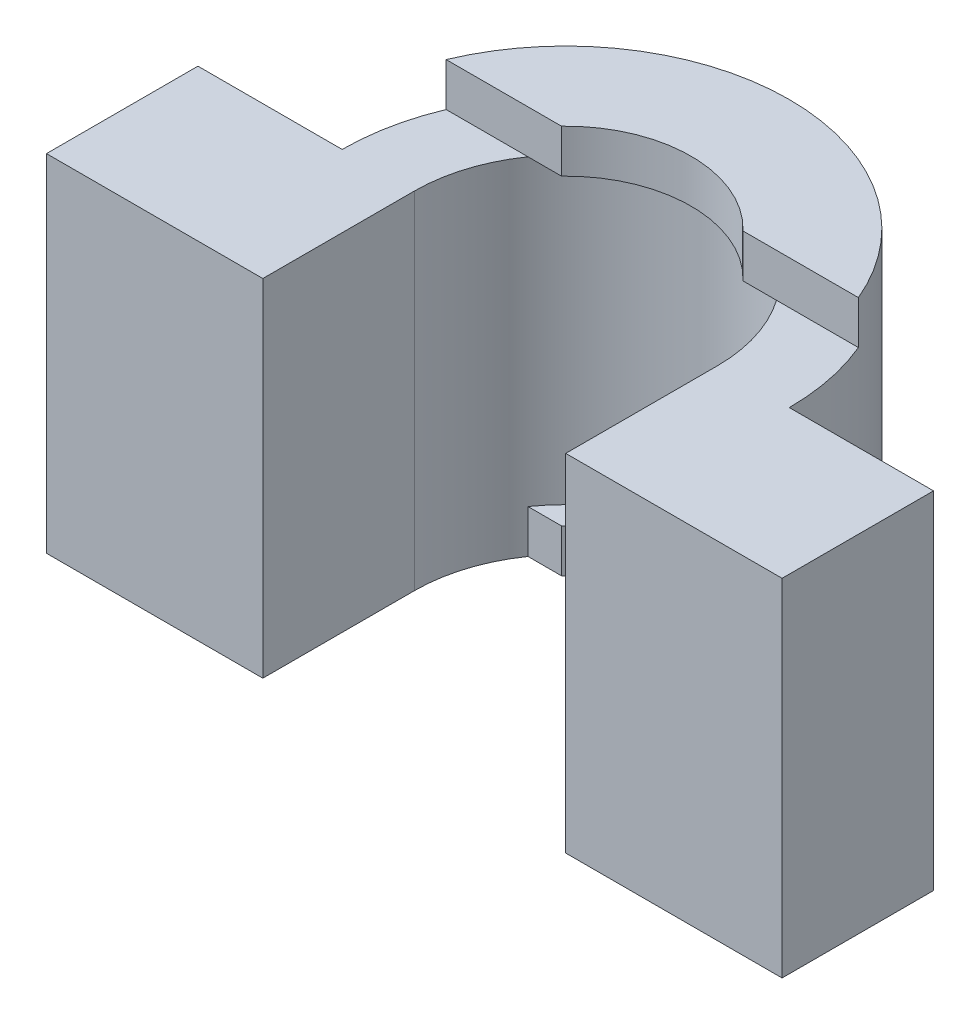
from build123d import *

# Parameters (mm, degrees)
BOSS_EXTRU_1_DEPTH = 21
BOSS_EXTRU_2_DEPTH = 3
BOSS_EXTRU_3_START = 3
BOSS_EXTRU_3_DEPTH = 3
BOSS_EXTRU_5_START = 3
BOSS_EXTRU_5_DEPTH = 3


with BuildPart() as part:
    # Esquisse1 → Boss.-Extru.1 (new body)
    with BuildSketch(Plane(origin=(0, 0, 0), x_dir=(1, 0, 0), z_dir=(0, 1, 0))):
        with BuildLine():
            ThreePointArc((-19.357142857, 1.428571429), (-3.857142857, 16.928571429), (11.642857143, 1.428571429))
            Line((11.642857143, 1.428571429), (21.642857143, 1.428571429))
            Line((21.642857143, 1.428571429), (21.642857143, -9.071428571))
            Line((21.642857143, -9.071428571), (11.642857143, -9.071428571))
            Line((11.642857143, -9.071428571), (6.642857143, -9.071428571))
            Line((6.642857143, -9.071428571), (6.642857143, 1.428571429))
            ThreePointArc((6.642857143, 1.428571429), (-3.857142857, 11.928571429), (-14.357142857, 1.428571429))
            Line((-14.357142857, 1.428571429), (-14.357142857, -9.071428571))
            Line((-14.357142857, -9.071428571), (-19.357142857, -9.071428571))
            Line((-19.357142857, -9.071428571), (-29.357142857, -9.071428571))
            Line((-29.357142857, -9.071428571), (-29.357142857, 1.428571429))
            Line((-29.357142857, 1.428571429), (-19.357142857, 1.428571429))
        make_face()
    extrude(amount=BOSS_EXTRU_1_DEPTH)

    # Esquisse2 → Boss.-Extru.2 (add)
    with BuildSketch(Plane(origin=(0, 21, 0), x_dir=(1, 0, 0), z_dir=(0, 1, 0))):
        with BuildLine():
            Line((-18.148749115, 7.428571429), (-10.148749115, 7.428571429))
            ThreePointArc((-10.148749115, 7.428571429), (-3.857142857, 10.122495129), (2.4344634, 7.428571429))
            Line((2.4344634, 7.428571429), (10.4344634, 7.428571429))
            ThreePointArc((10.4344634, 7.428571429), (-3.857142857, 16.928571733), (-18.148749115, 7.428571429))
        make_face()
    extrude(amount=BOSS_EXTRU_2_DEPTH)

    # Esquisse3 → Boss.-Extru.3 (add)
    with BuildSketch(Plane(origin=(0, 0, 0), x_dir=(-1, 0, 0), z_dir=(0, -1, 0)).offset(BOSS_EXTRU_3_START)):
        with BuildLine():
            Line((-10.434463071, 7.428571429), (-2.434463071, 7.428571429))
            ThreePointArc((-2.434463071, 7.428571429), (3.857142857, 10.12249489), (10.148748785, 7.428571429))
            Line((10.148748785, 7.428571429), (18.148748785, 7.428571429))
            ThreePointArc((18.148748785, 7.428571429), (3.857142857, 16.928571429), (-10.434463071, 7.428571429))
        make_face()
    extrude(amount=-BOSS_EXTRU_3_DEPTH)

    # Esquisse5 → Boss.-Extru.5 (add)
    with BuildSketch(Plane.XZ.offset(BOSS_EXTRU_5_START)):
        with BuildLine():
            Line((-18.148748785, -7.428571429), (-12.473986827, -7.428571429))
            ThreePointArc((-12.473986827, -7.428571429), (-13.875297919, -4.572862948), (-14.357142857, -1.428571429))
            Line((-14.357142857, -1.428571429), (-14.357142857, 9.071428571))
            Line((-14.357142857, 9.071428571), (-29.357142857, 9.071428571))
            Line((-29.357142857, 9.071428571), (-29.357142857, -1.428571429))
            Line((-29.357142857, -1.428571429), (-19.357142857, -1.428571429))
            ThreePointArc((-19.357142857, -1.428571429), (-19.052041539, -4.488809011), (-18.148748785, -7.428571429))
        make_face()
        with BuildLine():
            Line((4.759701113, -7.428571429), (10.434463071, -7.428571429))
            ThreePointArc((10.434463071, -7.428571429), (11.337755824, -4.488809011), (11.642857143, -1.428571429))
            Line((11.642857143, -1.428571429), (21.642857143, -1.428571429))
            Line((21.642857143, -1.428571429), (21.642857143, 9.071428571))
            Line((21.642857143, 9.071428571), (6.642857143, 9.071428571))
            Line((6.642857143, 9.071428571), (6.642857143, -1.428571429))
            ThreePointArc((6.642857143, -1.428571429), (6.161012205, -4.572862948), (4.759701113, -7.428571429))
        make_face()
    extrude(amount=-BOSS_EXTRU_5_DEPTH)


solid = part.part
